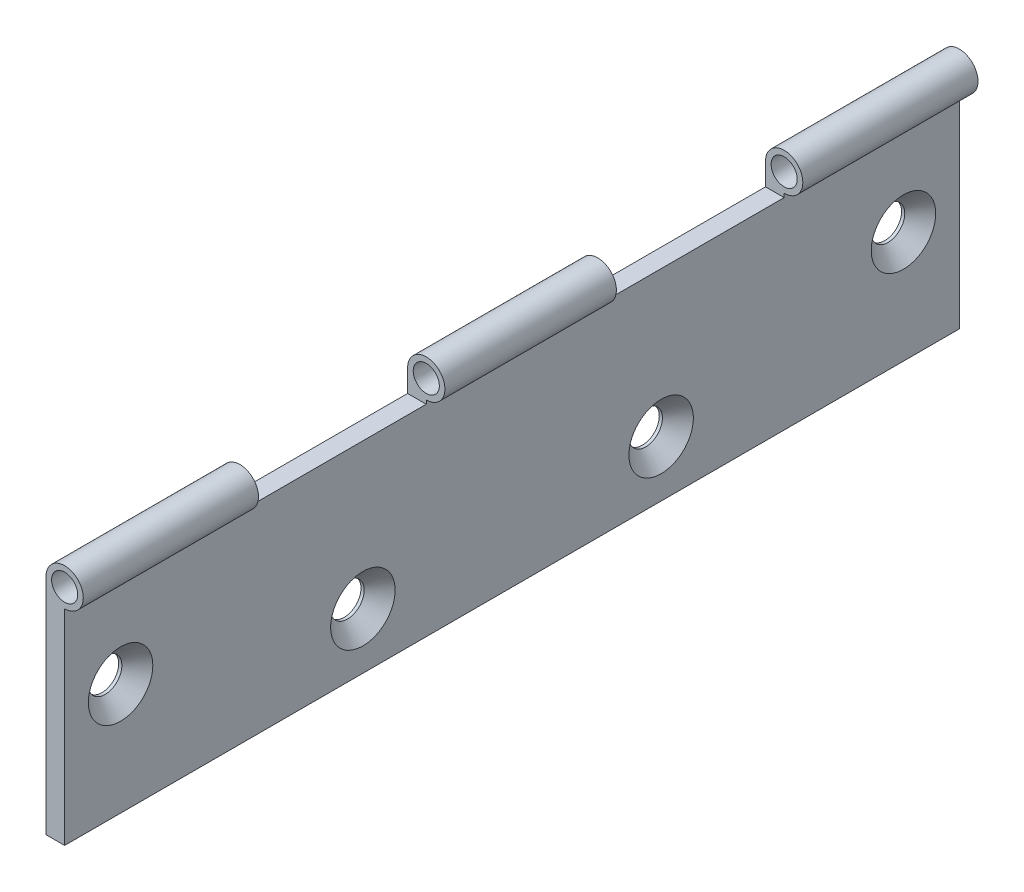
from build123d import *

# Parameters (mm, degrees)
SKETCH_1_W                 = 5
SKETCH_1_H                 = 60
EXTRUDE_1_DEPTH            = 120
SKETCH_2_R                 = 5
SKETCH_4_R                 = 3.5
CUT_EXTRUDE_1_DEPTH        = 249.847342763
HOLE_WIZARD_M81_AT_2_COUNT = 2
HOLE_WIZARD_M81_AT_2_PITCH = 66.708320321
CUT_EXTRUDE_2_DEPTH        = 137.565002837
CUT_EXTRUDE_2_DEPTH_BACK   = 137.565002837
SKETCH_8_W                 = 50
SKETCH_8_H                 = 11


with BuildPart() as part:
    # Эскиз1 → Вытянуть-Тонкостенный1 (new, symmetric)
    with BuildSketch(Plane.XY):
        with Locations((2.5, 30)):
            Rectangle(SKETCH_1_W, SKETCH_1_H)
    extrude(amount=EXTRUDE_1_DEPTH, both=True)

    # По траектории1: sweep along a curve in space
    with BuildLine() as sweep_1_path:
        Line((5, 60, 120), (5, 60, -120))
    # Эскиз2 → По траектории1 (sweep)
    with BuildSketch(Plane.XY.offset(120)):
        with Locations((5, 60)):
            Circle(SKETCH_2_R)
    sweep(path=sweep_1_path.line)

    # Эскиз4 → Вырез-Вытянуть1 (cut, through all)
    with BuildSketch(Plane.XY.offset(120)):
        with Locations((5, 60)):
            Circle(SKETCH_4_R)
    extrude(amount=-CUT_EXTRUDE_1_DEPTH, mode=Mode.SUBTRACT)

    # Эскиз5 → Зенковка для  винта с плоской головкой M81 (revolve, cut)
    with BuildSketch(Plane(origin=(5, 30, 105), x_dir=(0, 0, -1), z_dir=(0, 1, 0))):
        Polygon((0, 0), (0, 5), (4.5, 5), (4.5, 4.15), (8.65, 0), align=None)
    hole_wizard_m81 = revolve(axis=Axis((11.35, 30, 105), (-1, 0, 0)), mode=Mode.SUBTRACT)

    # Зенковка для  винта с плоской головкой M81 at 2: Зенковка для  винта с плоской головкой M81 ×2
    with Locations(*[Vector(0, -0.22485950669875843, -0.9743911956946198) * (i * HOLE_WIZARD_M81_AT_2_PITCH) for i in range(1, HOLE_WIZARD_M81_AT_2_COUNT)]):
        add(hole_wizard_m81, mode=Mode.SUBTRACT)

    # Зеркальное отражение1: Зенковка для  винта с плоской головкой M81 across plane
    add(hole_wizard_m81.mirror(Plane.XY), mode=Mode.SUBTRACT)

    # Зеркальное отражение1 copy 1 sketch → Зеркальное отражение1 copy 1 (revolve, cut)
    with BuildSketch(Plane(origin=(5, 15, -40), x_dir=(0, 0, 1), z_dir=(0, 1, 0))):
        Polygon((0, 0), (0, -5), (4.5, -5), (4.5, -4.15), (8.65, 0), align=None)
    revolve(axis=Axis((11.35, 15, -40), (1, 0, 0)), mode=Mode.SUBTRACT)

    # Эскиз8 → Вырез-Вытянуть2 (cut, two sides: drawn at the far end of the back side and taken through both)
    with BuildSketch(Plane(origin=(5, 0, 0), x_dir=(0, 0, -1), z_dir=(1, 0, 0)).offset(-CUT_EXTRUDE_2_DEPTH_BACK)):
        with Locations((-48, 59.5)):
            Rectangle(SKETCH_8_W, SKETCH_8_H)
        with Locations((48, 59.5)):
            Rectangle(SKETCH_8_W, SKETCH_8_H)
    extrude(amount=CUT_EXTRUDE_2_DEPTH + CUT_EXTRUDE_2_DEPTH_BACK, mode=Mode.SUBTRACT)


solid = part.part
